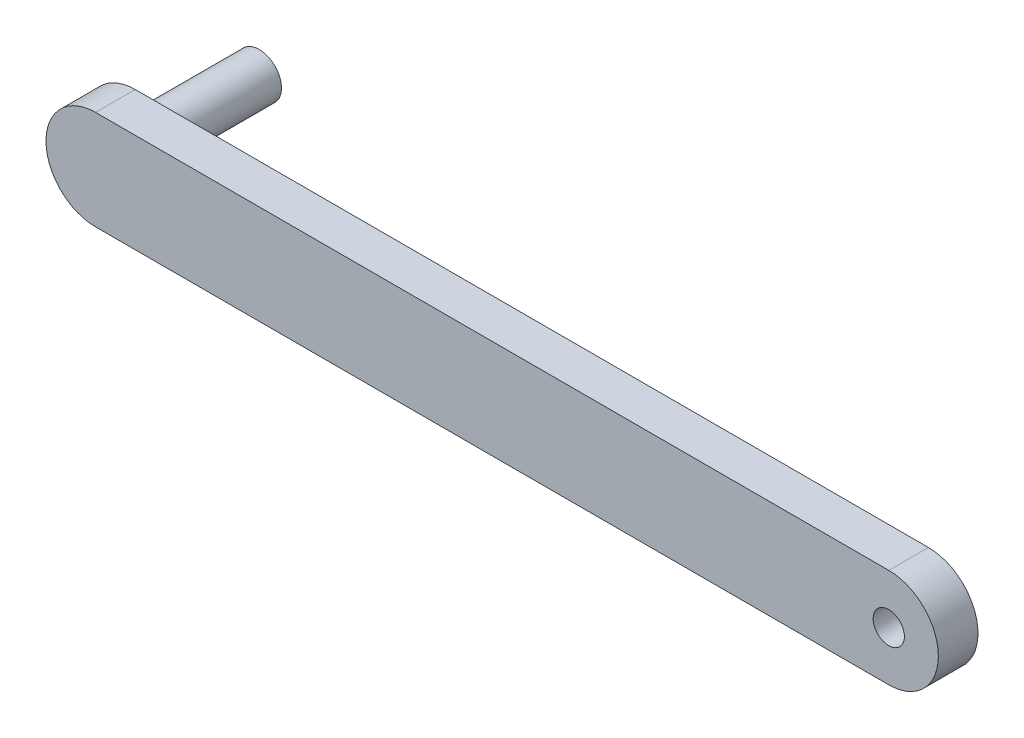
from build123d import *

# Parameters (mm, degrees)
BOSS_EXTRUDE1_DEPTH = 4
SKETCH2_R           = 2.25
BOSS_EXTRUDE2_DEPTH = 12.5
FILLET1_R           = 2.5
SKETCH4_R           = 1.575
CUT_EXTRUDE1_DEPTH  = 147.021402541


with BuildPart() as part:
    # Sketch1 → Boss-Extrude1 (new body)
    with BuildSketch(Plane.XY):
        with BuildLine():
            Line((-60, -5), (-140, -5))
            ThreePointArc((-140, -5), (-145, 0), (-140, 5))
            Line((-140, 5), (-60, 5))
            ThreePointArc((-60, 5), (-55, 0), (-60, -5))
        make_face()
    extrude(amount=BOSS_EXTRUDE1_DEPTH)

    # Sketch2 → Boss-Extrude2 (add)
    with BuildSketch(Plane(origin=(0, 0, 0), x_dir=(-1, 0, 0), z_dir=(0, 0, -1))):
        with Locations((140, 0)):
            Circle(SKETCH2_R)
    extrude(amount=BOSS_EXTRUDE2_DEPTH)

    # Fillet1
    fillet1_edges = [part.edges().sort_by_distance(p)[0] for p in [
        (-137.75, 0, 0),
    ]]
    fillet(fillet1_edges, radius=FILLET1_R)

    # Sketch4 → Cut-Extrude1 (cut, through all)
    with BuildSketch(Plane.XY.offset(4)):
        with Locations((-60, 0)):
            Circle(SKETCH4_R)
    extrude(amount=-CUT_EXTRUDE1_DEPTH, mode=Mode.SUBTRACT)


solid = part.part
